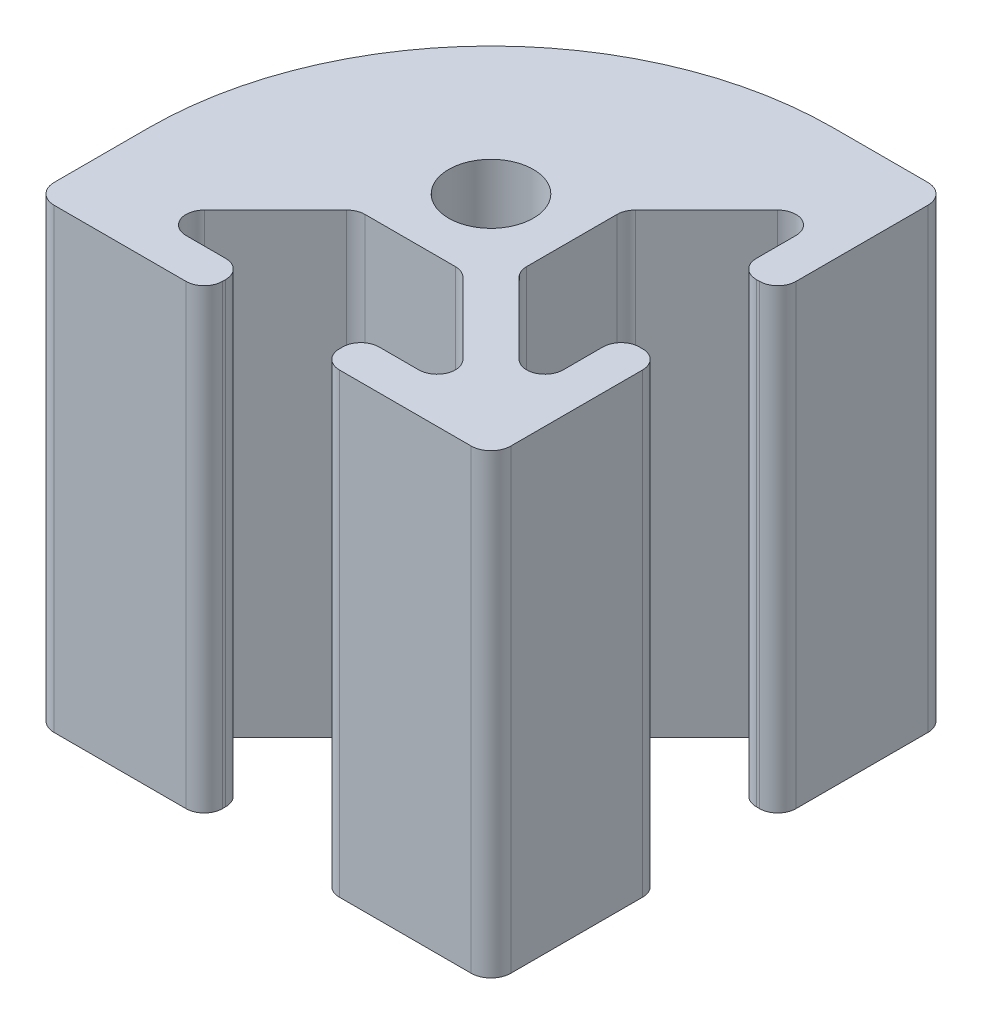
from build123d import *

# Parameters (mm, degrees)
SKETCH11_R               = 2.354570308
MEMBER_10_1012_S_1_DEPTH = 25.4


with BuildPart() as part:
    # Sketch11 → Member 10 1012-S_1 (new body)
    with BuildSketch(Plane(origin=(0, 0, 0), x_dir=(-1, 0, 0), z_dir=(0, 1, 0))):
        with BuildLine():
            Line((24.2951, 0), (16.9672, 0))
            ThreePointArc((16.9672, 0), (16.24877951, -0.29757951), (15.9512, -1.016))
            Line((15.9512, -1.016), (15.9512, -1.1938))
            ThreePointArc((15.9512, -1.1938), (16.24877951, -1.91222049), (16.9672, -2.2098))
            Line((16.9672, -2.2098), (19.174794456, -2.2098))
            ThreePointArc((19.174794456, -2.2098), (20.113456061, -2.836993633), (19.893214945, -3.94422049))
            Line((19.893214945, -3.94422049), (15.930814945, -7.90662049))
            ThreePointArc((15.930814945, -7.90662049), (15.601200823, -8.126861605), (15.212394456, -8.2042))
            Line((15.212394456, -8.2042), (10.187605544, -8.2042))
            ThreePointArc((10.187605544, -8.2042), (9.798799177, -8.126861605), (9.469185055, -7.90662049))
            Line((9.469185055, -7.90662049), (5.506785055, -3.94422049))
            ThreePointArc((5.506785055, -3.94422049), (5.286543939, -2.836993633), (6.225205544, -2.2098))
            Line((6.225205544, -2.2098), (8.4328, -2.2098))
            ThreePointArc((8.4328, -2.2098), (9.15122049, -1.91222049), (9.4488, -1.1938))
            Line((9.4488, -1.1938), (9.4488, -1.016))
            ThreePointArc((9.4488, -1.016), (9.15122049, -0.29757951), (8.4328, 0))
            Line((8.4328, 0), (1.1049, 0))
            ThreePointArc((1.1049, 0), (0.323617717, -0.323617717), (0, -1.1049))
            Line((0, -1.1049), (0, -8.4328))
            ThreePointArc((0, -8.4328), (0.29757951, -9.15122049), (1.016, -9.4488))
            Line((1.016, -9.4488), (1.1938, -9.4488))
            ThreePointArc((1.1938, -9.4488), (1.91222049, -9.15122049), (2.2098, -8.4328))
            Line((2.2098, -8.4328), (2.2098, -6.225205544))
            ThreePointArc((2.2098, -6.225205544), (2.836993633, -5.286543939), (3.94422049, -5.506785055))
            Line((3.94422049, -5.506785055), (7.90662049, -9.469185055))
            ThreePointArc((7.90662049, -9.469185055), (8.126861605, -9.798799177), (8.2042, -10.187605544))
            Line((8.2042, -10.187605544), (8.2042, -15.212394456))
            ThreePointArc((8.2042, -15.212394456), (8.126861605, -15.601200823), (7.90662049, -15.930814945))
            Line((7.90662049, -15.930814945), (3.94422049, -19.893214945))
            ThreePointArc((3.94422049, -19.893214945), (2.836993633, -20.113456061), (2.2098, -19.174794456))
            Line((2.2098, -19.174794456), (2.2098, -16.9672))
            ThreePointArc((2.2098, -16.9672), (1.91222049, -16.24877951), (1.1938, -15.9512))
            Line((1.1938, -15.9512), (1.016, -15.9512))
            ThreePointArc((1.016, -15.9512), (0.29757951, -16.24877951), (0, -16.9672))
            Line((0, -16.9672), (0, -24.2951))
            ThreePointArc((0, -24.2951), (0.323617717, -25.076382283), (1.1049, -25.4))
            Line((1.1049, -25.4), (6.35, -25.4))
            ThreePointArc((6.35, -25.4), (19.820384182, -19.820384182), (25.4, -6.35))
            Line((25.4, -6.35), (25.4, -1.1049))
            ThreePointArc((25.4, -1.1049), (25.076382283, -0.323617717), (24.2951, 0))
        make_face()
        with Locations((12.7, -12.7)):
            Circle(SKETCH11_R, mode=Mode.SUBTRACT)
    extrude(amount=MEMBER_10_1012_S_1_DEPTH)


solid = part.part
